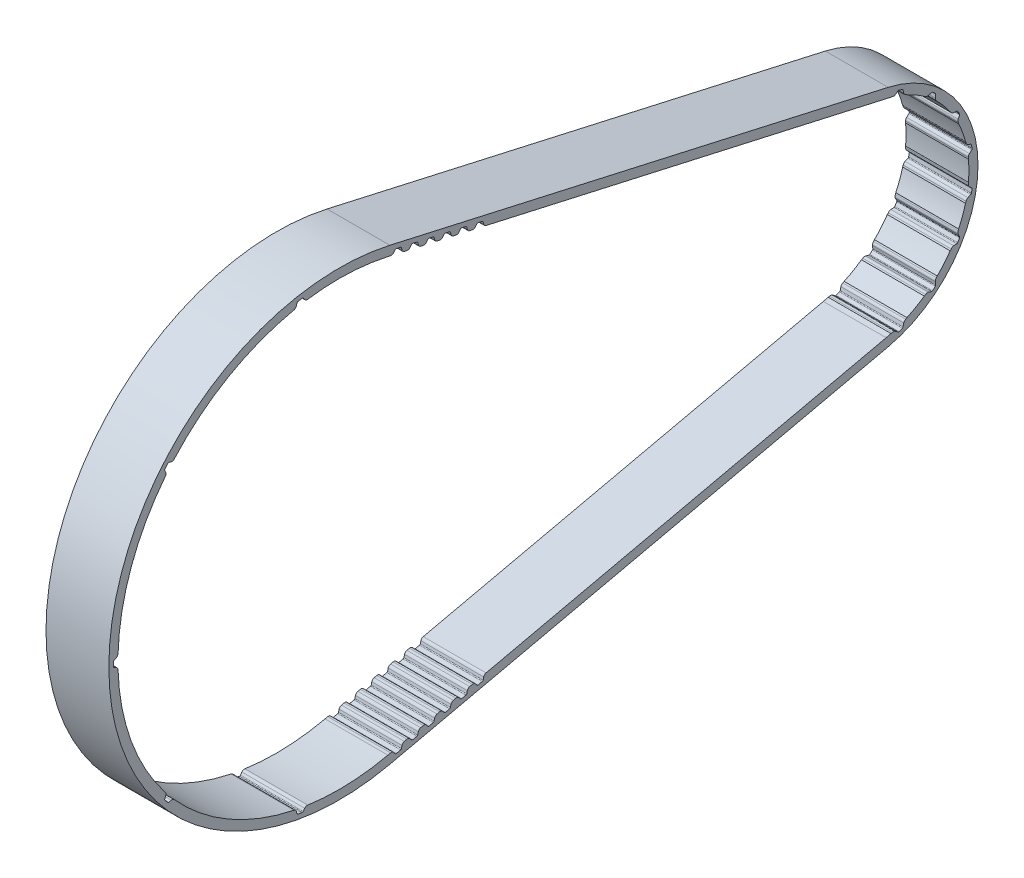
from build123d import *

# Parameters (mm, degrees)
SKETCH_2_W               = 60
SKETCH_2_H               = 8.7
CUT_EXTRUDE_1_DEPTH      = 652.229606207
PATTERN_CIRCULAR_1_COUNT = 9
CUT_EXTRUDE_2_DEPTH      = 652.229606207
PATTERN_CIRCULAR_2_COUNT = 18
SKETCH_11_W              = 60
SKETCH_11_H              = 487.74993593
EXTRUDE_11_DEPTH         = 8.7
CUT_EXTRUDE_3_REACH      = 653.23
PATTERN_LINEAR_1_COUNT   = 6
PATTERN_LINEAR_1_PITCH   = 16
MIRROR_1_COPY_1_REACH    = 653.23
MIRROR_1_COPY_2_REACH    = 653.23
MIRROR_1_COPY_3_REACH    = 653.23
MIRROR_1_COPY_4_REACH    = 653.23
MIRROR_1_COPY_5_REACH    = 653.23
SCALE_1_SCALE            = 0.1
SCALE_2_SCALE            = 0.3
SCALE_3_SCALE            = 10
SCALE_4_SCALE            = 0.5
SCALE_5_SCALE            = 1.3


with BuildPart() as part:
    # 扫描1: sweep along a path in 草图1
    with BuildLine(Plane(origin=(0, 0, 0), x_dir=(0, 0, -1), z_dir=(1, 0, 0))) as sweep_1_path:
        Line((48.4, 214.609971809), (524.2, 107.304985905))
        ThreePointArc((524.2, 107.304985905), (610, 0), (524.2, -107.304985905))
        Line((524.2, -107.304985905), (48.4, -214.609971809))
        ThreePointArc((48.4, -214.609971809), (-220, 0), (48.4, 214.609971809))
    # 草图2 → 扫描1 (sweep)
    with BuildSketch(Plane.XY):
        with Locations((0, 215.65)):
            Rectangle(SKETCH_2_W, SKETCH_2_H)
    sweep(path=sweep_1_path.line)

    # 草图3 → 切除-拉伸1 (cut, through all)
    with BuildSketch(Plane(origin=(30, 0, 0), x_dir=(0, 0, -1), z_dir=(1, 0, 0))):
        with BuildLine():
            Line((-215.549470824, -2.11904302), (-215.549470824, 2.11904302))
            ThreePointArc((-215.549470824, 2.11904302), (-215.398900967, 2.646744102), (-214.99253396, 3.015533432))
            Line((-214.99253396, 3.015533432), (-212.850157053, 4.074338097))
            ThreePointArc((-212.850157053, 4.074338097), (-211.641719603, 5.171028597), (-211.193961171, 6.740284315))
            Line((-211.193961171, 6.740284315), (-208.773566776, 6.740284315))
            Line((-208.773566776, 6.740284315), (-208.773566776, -6.740284315))
            Line((-208.773566776, -6.740284315), (-211.193961171, -6.740284315))
            ThreePointArc((-211.193961171, -6.740284315), (-211.641719603, -5.171028597), (-212.850157053, -4.074338097))
            Line((-212.850157053, -4.074338097), (-214.99253396, -3.015533432))
            ThreePointArc((-214.99253396, -3.015533432), (-215.398900967, -2.646744102), (-215.549470824, -2.11904302))
        make_face()
    cut_extrude_1 = extrude(amount=-CUT_EXTRUDE_1_DEPTH, mode=Mode.SUBTRACT)

    # 阵列(圆周)1: 切除-拉伸1 ×9 about axis
    pattern_circular_1_axis = Axis((-33.0002795, 0, 0), (1, 0, 0))
    for i in range(1, PATTERN_CIRCULAR_1_COUNT):
        add(cut_extrude_1.rotate(pattern_circular_1_axis, i * 360 / PATTERN_CIRCULAR_1_COUNT), mode=Mode.SUBTRACT)

    # 草图4 → 切除-拉伸2 (cut, through all)
    with BuildSketch(Plane(origin=(30, 0, 0), x_dir=(0, 0, -1), z_dir=(1, 0, 0))):
        with BuildLine():
            Line((603.748167855, 20.060732198), (604.352562255, 16.633041225))
            ThreePointArc((604.352562255, 16.633041225), (604.316683663, 16.143903829), (604.052547121, 15.73065505))
            Line((604.052547121, 15.73065505), (601.823636103, 13.636154944))
            ThreePointArc((601.823636103, 13.636154944), (601.038157746, 12.407252766), (600.931463468, 10.952676146))
            ThreePointArc((600.931463468, 10.952676146), (600.88568135, 9.706416037), (600.332901632, 8.588518525))
            Line((600.332901632, 8.588518525), (599.946655715, 10.779027969))
            Line((599.946655715, 10.779027969), (597.605779539, 24.054796471))
            Line((597.605779539, 24.054796471), (597.219533622, 26.245305915))
            ThreePointArc((597.219533622, 26.245305915), (598.121320112, 25.383887671), (598.590587292, 24.228444649))
            ThreePointArc((598.590587292, 24.228444649), (599.188341621, 22.898081325), (600.346759136, 22.011940437))
            Line((600.346759136, 22.011940437), (603.157611598, 20.806086609))
            ThreePointArc((603.157611598, 20.806086609), (603.547158164, 20.508099799), (603.748167855, 20.060732198))
        make_face()
    cut_extrude_2 = extrude(amount=-CUT_EXTRUDE_2_DEPTH, mode=Mode.SUBTRACT)

    # 阵列(圆周)2: 切除-拉伸2 ×18 about axis
    pattern_circular_2_axis = Axis((-33.0002795, 0, -500), (1, 0, 0))
    for i in range(1, PATTERN_CIRCULAR_2_COUNT):
        add(cut_extrude_2.rotate(pattern_circular_2_axis, i * 360 / PATTERN_CIRCULAR_2_COUNT), mode=Mode.SUBTRACT)

    # 草图11 → 拉伸11 (add)
    with BuildSketch(Plane(origin=(0, 214.609971809, -48.4), x_dir=(1, 0, 0), z_dir=(0, 0.975499871860576, -0.22000000000000003))):
        with Locations((0, 243.874967965)):
            Rectangle(SKETCH_11_W, SKETCH_11_H)
    extrude_11 = extrude(amount=-EXTRUDE_11_DEPTH)

    # 镜向2: 拉伸11 across plane
    add(extrude_11.mirror(Plane.ZX))

    # 草图5 → 切除-拉伸3 (cut, up to next)
    with BuildSketch(Plane(origin=(30, 0, 0), x_dir=(0, 0, -1), z_dir=(1, 0, 0)), mode=Mode.PRIVATE) as cut_extrude_3_sk1:
        with BuildLine():
            Line((54.48230716, 208.784652825), (58.61655955, 207.852273897))
            ThreePointArc((58.61655955, 207.852273897), (59.098206519, 207.589298782), (59.368559721, 207.111754166))
            Line((59.368559721, 207.111754166), (59.930100617, 204.788928742))
            ThreePointArc((59.930100617, 204.788928742), (60.73406582, 203.368826254), (62.166367717, 202.586801703))
            Line((62.166367717, 202.586801703), (61.726367717, 200.63580196))
            Line((61.726367717, 200.63580196), (48.576074745, 203.601527058))
            Line((48.576074745, 203.601527058), (49.016074745, 205.552526802))
            ThreePointArc((49.016074745, 205.552526802), (50.645390353, 205.644078837), (51.981068034, 206.581637505))
            Line((51.981068034, 206.581637505), (53.485254769, 208.438588876))
            ThreePointArc((53.485254769, 208.438588876), (53.934409454, 208.753866187), (54.48230716, 208.784652825))
        make_face()
    cut_extrude_3_tool1 = extrude(cut_extrude_3_sk1.sketch, amount=-CUT_EXTRUDE_3_REACH, mode=Mode.PRIVATE) & part.part
    cut_extrude_3 = cut_extrude_3_tool1.solids().sort_by_distance((30, 204.682778, -55.729494))[0]
    add(cut_extrude_3, mode=Mode.SUBTRACT)

    # 阵列(线性)1: 切除-拉伸3 ×6
    with Locations(*[Vector(0, -0.21999999999999997, -0.975499871860576) * (i * PATTERN_LINEAR_1_PITCH) for i in range(1, PATTERN_LINEAR_1_COUNT)]):
        add(cut_extrude_3, mode=Mode.SUBTRACT)

    # 镜向1: 切除-拉伸3 across plane
    add(cut_extrude_3.mirror(Plane.ZX), mode=Mode.SUBTRACT)

    # 镜向1 copy 1 sketch → 镜向1 copy 1 (cut, up to next)
    with BuildSketch(Plane(origin=(30, 3.52, -15.60799795), x_dir=(0, 0, -1), z_dir=(1, 0, 0)), mode=Mode.PRIVATE) as mirror_1_copy_1_sk1:
        with BuildLine():
            Line((54.48230716, -208.784652825), (58.61655955, -207.852273897))
            ThreePointArc((58.61655955, -207.852273897), (59.098206519, -207.589298782), (59.368559721, -207.111754166))
            Line((59.368559721, -207.111754166), (59.930100617, -204.788928742))
            ThreePointArc((59.930100617, -204.788928742), (60.73406582, -203.368826254), (62.166367717, -202.586801703))
            Line((62.166367717, -202.586801703), (61.726367717, -200.63580196))
            Line((61.726367717, -200.63580196), (48.576074745, -203.601527058))
            Line((48.576074745, -203.601527058), (49.016074745, -205.552526802))
            ThreePointArc((49.016074745, -205.552526802), (50.645390353, -205.644078837), (51.981068034, -206.581637505))
            Line((51.981068034, -206.581637505), (53.485254769, -208.438588876))
            ThreePointArc((53.485254769, -208.438588876), (53.934409454, -208.753866187), (54.48230716, -208.784652825))
        make_face()
    mirror_1_copy_1_tool1 = extrude(mirror_1_copy_1_sk1.sketch, amount=-MIRROR_1_COPY_1_REACH, mode=Mode.PRIVATE) & part.part
    add(mirror_1_copy_1_tool1.solids().sort_by_distance((30, -201.162778, -71.33749195))[0], mode=Mode.SUBTRACT)

    # 镜向1 copy 2 sketch → 镜向1 copy 2 (cut, up to next)
    with BuildSketch(Plane(origin=(30, 7.04, -31.2159959), x_dir=(0, 0, -1), z_dir=(1, 0, 0)), mode=Mode.PRIVATE) as mirror_1_copy_2_sk1:
        with BuildLine():
            Line((54.48230716, -208.784652825), (58.61655955, -207.852273897))
            ThreePointArc((58.61655955, -207.852273897), (59.098206519, -207.589298782), (59.368559721, -207.111754166))
            Line((59.368559721, -207.111754166), (59.930100617, -204.788928742))
            ThreePointArc((59.930100617, -204.788928742), (60.73406582, -203.368826254), (62.166367717, -202.586801703))
            Line((62.166367717, -202.586801703), (61.726367717, -200.63580196))
            Line((61.726367717, -200.63580196), (48.576074745, -203.601527058))
            Line((48.576074745, -203.601527058), (49.016074745, -205.552526802))
            ThreePointArc((49.016074745, -205.552526802), (50.645390353, -205.644078837), (51.981068034, -206.581637505))
            Line((51.981068034, -206.581637505), (53.485254769, -208.438588876))
            ThreePointArc((53.485254769, -208.438588876), (53.934409454, -208.753866187), (54.48230716, -208.784652825))
        make_face()
    mirror_1_copy_2_tool1 = extrude(mirror_1_copy_2_sk1.sketch, amount=-MIRROR_1_COPY_2_REACH, mode=Mode.PRIVATE) & part.part
    add(mirror_1_copy_2_tool1.solids().sort_by_distance((30, -197.642778, -86.9454899))[0], mode=Mode.SUBTRACT)

    # 镜向1 copy 3 sketch → 镜向1 copy 3 (cut, up to next)
    with BuildSketch(Plane(origin=(30, 10.56, -46.823993849), x_dir=(0, 0, -1), z_dir=(1, 0, 0)), mode=Mode.PRIVATE) as mirror_1_copy_3_sk1:
        with BuildLine():
            Line((54.48230716, -208.784652825), (58.61655955, -207.852273897))
            ThreePointArc((58.61655955, -207.852273897), (59.098206519, -207.589298782), (59.368559721, -207.111754166))
            Line((59.368559721, -207.111754166), (59.930100617, -204.788928742))
            ThreePointArc((59.930100617, -204.788928742), (60.73406582, -203.368826254), (62.166367717, -202.586801703))
            Line((62.166367717, -202.586801703), (61.726367717, -200.63580196))
            Line((61.726367717, -200.63580196), (48.576074745, -203.601527058))
            Line((48.576074745, -203.601527058), (49.016074745, -205.552526802))
            ThreePointArc((49.016074745, -205.552526802), (50.645390353, -205.644078837), (51.981068034, -206.581637505))
            Line((51.981068034, -206.581637505), (53.485254769, -208.438588876))
            ThreePointArc((53.485254769, -208.438588876), (53.934409454, -208.753866187), (54.48230716, -208.784652825))
        make_face()
    mirror_1_copy_3_tool1 = extrude(mirror_1_copy_3_sk1.sketch, amount=-MIRROR_1_COPY_3_REACH, mode=Mode.PRIVATE) & part.part
    add(mirror_1_copy_3_tool1.solids().sort_by_distance((30, -194.122778, -102.553487849))[0], mode=Mode.SUBTRACT)

    # 镜向1 copy 4 sketch → 镜向1 copy 4 (cut, up to next)
    with BuildSketch(Plane(origin=(30, 14.08, -62.431991799), x_dir=(0, 0, -1), z_dir=(1, 0, 0)), mode=Mode.PRIVATE) as mirror_1_copy_4_sk1:
        with BuildLine():
            Line((54.48230716, -208.784652825), (58.61655955, -207.852273897))
            ThreePointArc((58.61655955, -207.852273897), (59.098206519, -207.589298782), (59.368559721, -207.111754166))
            Line((59.368559721, -207.111754166), (59.930100617, -204.788928742))
            ThreePointArc((59.930100617, -204.788928742), (60.73406582, -203.368826254), (62.166367717, -202.586801703))
            Line((62.166367717, -202.586801703), (61.726367717, -200.63580196))
            Line((61.726367717, -200.63580196), (48.576074745, -203.601527058))
            Line((48.576074745, -203.601527058), (49.016074745, -205.552526802))
            ThreePointArc((49.016074745, -205.552526802), (50.645390353, -205.644078837), (51.981068034, -206.581637505))
            Line((51.981068034, -206.581637505), (53.485254769, -208.438588876))
            ThreePointArc((53.485254769, -208.438588876), (53.934409454, -208.753866187), (54.48230716, -208.784652825))
        make_face()
    mirror_1_copy_4_tool1 = extrude(mirror_1_copy_4_sk1.sketch, amount=-MIRROR_1_COPY_4_REACH, mode=Mode.PRIVATE) & part.part
    add(mirror_1_copy_4_tool1.solids().sort_by_distance((30, -190.602778, -118.161485799))[0], mode=Mode.SUBTRACT)

    # 镜向1 copy 5 sketch → 镜向1 copy 5 (cut, up to next)
    with BuildSketch(Plane(origin=(30, 17.6, -78.039989749), x_dir=(0, 0, -1), z_dir=(1, 0, 0)), mode=Mode.PRIVATE) as mirror_1_copy_5_sk1:
        with BuildLine():
            Line((54.48230716, -208.784652825), (58.61655955, -207.852273897))
            ThreePointArc((58.61655955, -207.852273897), (59.098206519, -207.589298782), (59.368559721, -207.111754166))
            Line((59.368559721, -207.111754166), (59.930100617, -204.788928742))
            ThreePointArc((59.930100617, -204.788928742), (60.73406582, -203.368826254), (62.166367717, -202.586801703))
            Line((62.166367717, -202.586801703), (61.726367717, -200.63580196))
            Line((61.726367717, -200.63580196), (48.576074745, -203.601527058))
            Line((48.576074745, -203.601527058), (49.016074745, -205.552526802))
            ThreePointArc((49.016074745, -205.552526802), (50.645390353, -205.644078837), (51.981068034, -206.581637505))
            Line((51.981068034, -206.581637505), (53.485254769, -208.438588876))
            ThreePointArc((53.485254769, -208.438588876), (53.934409454, -208.753866187), (54.48230716, -208.784652825))
        make_face()
    mirror_1_copy_5_tool1 = extrude(mirror_1_copy_5_sk1.sketch, amount=-MIRROR_1_COPY_5_REACH, mode=Mode.PRIVATE) & part.part
    add(mirror_1_copy_5_tool1.solids().sort_by_distance((30, -187.082778, -133.769483749))[0], mode=Mode.SUBTRACT)


with BuildPart() as part_1:
    # 缩放比例1: scaled about (0, 0, -171.327909265)
    add(part.part.scale(SCALE_1_SCALE).moved(Location((0, 0, -154.195118338))))


with BuildPart() as part_2:
    # 缩放比例2: scaled about (0, 0, -171.327909265)
    add(part_1.part.scale(SCALE_2_SCALE).moved(Location((0, 0, -119.929536485))))


with BuildPart() as part_3:
    # 缩放比例3: scaled about (0, 0, -171.327909265)
    add(part_2.part.scale(SCALE_3_SCALE).moved(Location((0, 0, 1541.951183385))))


with BuildPart() as part_4:
    # 缩放比例4: scaled about (0, 0, -171.327909265)
    add(part_3.part.scale(SCALE_4_SCALE).moved(Location((0, 0, -85.663954632))))


with BuildPart() as part_5:
    # 缩放比例5: scaled about (0, 0, -171.327909265)
    add(part_4.part.scale(SCALE_5_SCALE).moved(Location((0, 0, 51.39837278))))


solid = part_5.part
